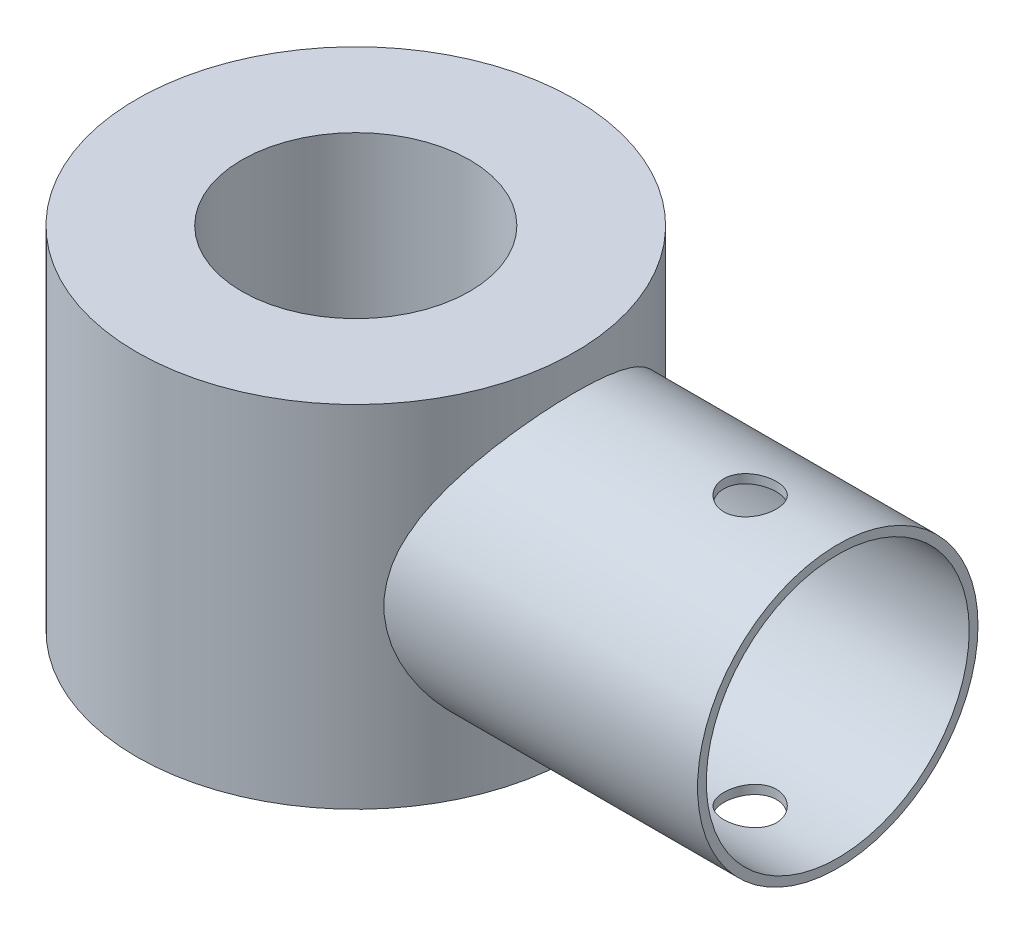
from build123d import *

# Parameters (mm, degrees)
SKETCH1_R           = 25
SKETCH1_R_2         = 13
BOSS_EXTRUDE1_DEPTH = 40
SKETCH2_R           = 16
SKETCH2_R_2         = 15
BOSS_EXTRUDE2_DEPTH = 40
SKETCH3_R           = 3
CUT_EXTRUDE1_DEPTH  = 39


with BuildPart() as part:
    # Sketch1 → Boss-Extrude1 (new body)
    with BuildSketch(Plane(origin=(0, 0, 0), x_dir=(1, 0, 0), z_dir=(0, 1, 0))):
        with Locations(Location((0, 0, 0), (0, 0, 270))):
            Circle(SKETCH1_R)
        with Locations(Location((0, 0, 0), (0, 0, 270))):
            Circle(SKETCH1_R_2, mode=Mode.SUBTRACT)
    extrude(amount=BOSS_EXTRUDE1_DEPTH)


with BuildPart() as body_2:
    # Sketch2 → Boss-Extrude2 (new body)
    with BuildSketch(Plane(origin=(55, 0, 0), x_dir=(0, 0, -1), z_dir=(1, 0, 0))):
        with Locations((0, 20)):
            Circle(SKETCH2_R)
        with Locations((0, 20)):
            Circle(SKETCH2_R_2, mode=Mode.SUBTRACT)
    extrude(amount=-BOSS_EXTRUDE2_DEPTH)

    # Sketch3 → Cut-Extrude1 (cut)
    with BuildSketch(Plane(origin=(0, 0, 0), x_dir=(1, 0, 0), z_dir=(0, 1, 0))):
        with Locations(Location((45, 0, 0), (0, 0, 90))):
            Circle(SKETCH3_R)
    extrude(amount=CUT_EXTRUDE1_DEPTH, mode=Mode.SUBTRACT)


solid = Compound([part.part, body_2.part])
